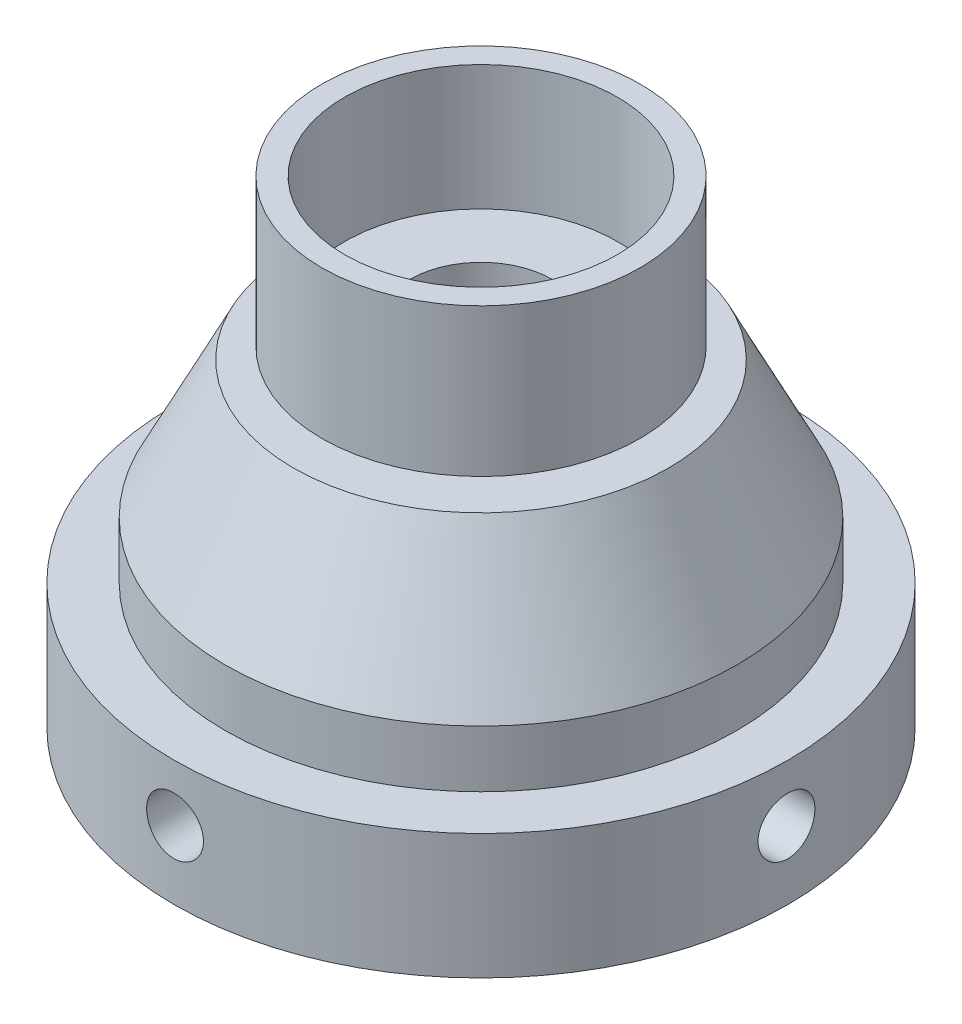
from build123d import *

# Parameters (mm, degrees)
SKETCH2_W          = 3.901140831
SKETCH2_H          = 5
CUT_EXTRUDE1_DEPTH = 99.366661019
CIRPATTERN1_COUNT  = 4


with BuildPart() as part:
    # Sketch1 → Revolve1 (revolve)
    with BuildSketch(Plane.XY, mode=Mode.PRIVATE) as revolve1_sk:
        Polygon((24, 84), (24, 62), (12.5, 62), (12.5, 6), (31, 6), (31, 0), (54, 0), (54, 22), (45, 22), (45, 32), (33, 56), (25.142857143, 56), (25.142857143, 58), (28, 58), (28, 84), align=None)
    revolve(revolve1_sk.sketch.rotate(Axis((0, 70.99827883, 0), (0, -1, 0)), 90), axis=Axis((0, 70.99827883, 0), (0, -1, 0)))

    # Sketch2 → Cut-Extrude1 (cut, through all)
    with BuildSketch(Plane(origin=(0, 62, 0), x_dir=(1, 0, 0), z_dir=(0, 1, 0))):
        with Locations((12.549429585, 0)):
            Rectangle(SKETCH2_W, SKETCH2_H)
    extrude(amount=-CUT_EXTRUDE1_DEPTH, mode=Mode.SUBTRACT)

    # Sketch10 → Ø10.0 (10) Diameter Hole1 (revolve, cut)
    with BuildSketch(Plane(origin=(-0.044253974, 12, 53.999981867), x_dir=(0.99999966419503, 0, 0.0008195180458038231), z_dir=(0, 1, 0))):
        Polygon((0, 0), (0, 13.004303095), (5, 10), (5, 0), align=None)
    f_10_0_10_diameter_hole1 = revolve(axis=Axis((-0.049457914, 12, 60.349979734), (0.000819518045803823, 0, -0.99999966419503)), mode=Mode.SUBTRACT)

    # CirPattern1: Ø10.0 (10) Diameter Hole1 ×4 about axis
    cirpattern1_axis = Axis((0, 0, 0), (0, 1, 0))
    for i in range(1, CIRPATTERN1_COUNT):
        add(f_10_0_10_diameter_hole1.rotate(cirpattern1_axis, i * 360 / CIRPATTERN1_COUNT), mode=Mode.SUBTRACT)


solid = part.part
